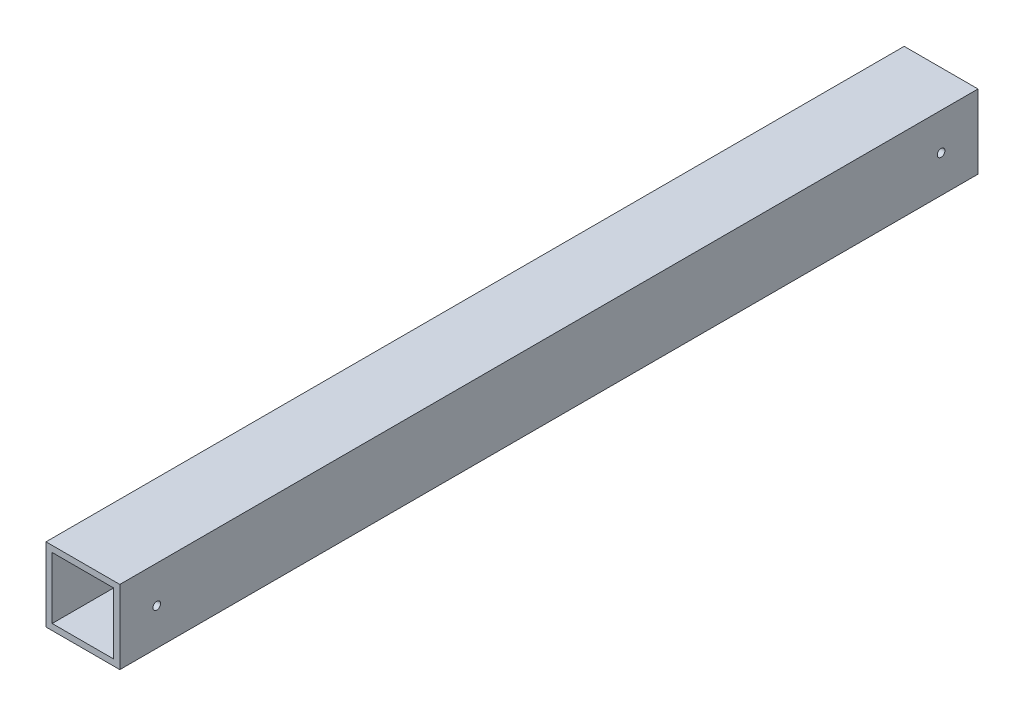
from build123d import *

# Parameters (mm, degrees)
SKETCH_1_W         = 24
SKETCH_1_H         = 24
SKETCH_1_W_2       = 20
SKETCH_1_H_2       = 20
EXTRUDE_1_DEPTH    = 139.5
HOLE_WIZARD_M3_2_D = 2.5


with BuildPart() as part:
    # 草图1 → 凸台-拉伸1 (new, symmetric)
    with BuildSketch(Plane.XY):
        Rectangle(SKETCH_1_W, SKETCH_1_H)
        Rectangle(SKETCH_1_W_2, SKETCH_1_H_2, mode=Mode.SUBTRACT)
    extrude(amount=EXTRUDE_1_DEPTH, both=True)

    # M3 螺纹孔的螺纹孔钻头2 (through all)
    with Locations(Plane(origin=(-12, 0, -127.5), x_dir=(0, -1, 0), z_dir=(-1, 0, 0))):
        with Locations((0, 0)):
            hole_wizard_m3_2 = Hole(HOLE_WIZARD_M3_2_D / 2)

    # 镜向1: M3 螺纹孔的螺纹孔钻头2 across plane
    add(hole_wizard_m3_2.mirror(Plane.XY), mode=Mode.SUBTRACT)


solid = part.part
